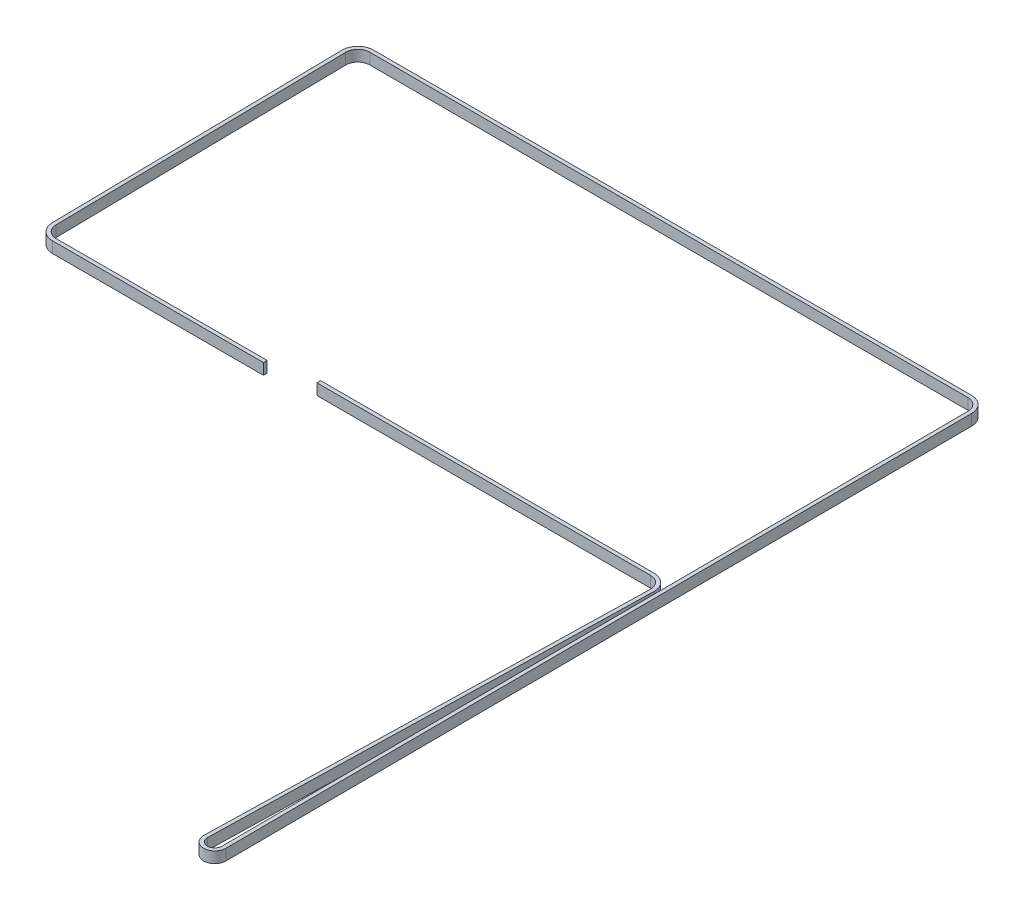
from build123d import *

# Parameters (mm, degrees)
EXTRUDE_THIN1_DEPTH      = 5
EXTRUDE_THIN1_DEPTH_BACK = 1


with BuildPart() as part:
    # Sketch1 → Extrude-Thin1 (new, two sides: drawn at the far end of the back side and taken through both)
    with BuildSketch(Plane(origin=(0, 494, 0), x_dir=(1, 0, 0), z_dir=(0, 1, 0)).offset(-EXTRUDE_THIN1_DEPTH_BACK)):
        with BuildLine():
            Line((-21.192485275, 22.077376905), (159.5, 22.077376905))
            ThreePointArc((159.5, 22.077376905), (164.149331935, 20.119811555), (165.998241995, 15.426211538))
            Line((165.998241995, 15.426211538), (160.501622773, -220.860462738))
            ThreePointArc((160.501622773, -220.860462738), (166.44500383, -226.999747946), (172.499927204, -220.970444157))
            Line((172.499927204, -220.970444157), (170.499896872, 185.041870778))
            ThreePointArc((170.499896872, 185.041870778), (167.995585809, 191.02519301), (162, 193.5))
            Line((162, 193.5), (-162, 193.5))
            ThreePointArc((-162, 193.5), (-168.057344942, 190.963100892), (-170.498955066, 184.866722883))
            Line((-170.498955066, 184.866722883), (-167.998955066, 25.444099787))
            ThreePointArc((-167.998955066, 25.444099787), (-165.463100892, 19.520031962), (-159.5, 17.077376905))
            Line((-159.5, 17.077376905), (-45.192485275, 17.077376905))
            Line((-45.192485275, 17.077376905), (-45.192485275, 19.077376905))
            Line((-45.192485275, 19.077376905), (-159.5, 19.077376905))
            ThreePointArc((-159.5, 19.077376905), (-164.060018329, 20.945289596), (-165.999200933, 25.475459109))
            Line((-165.999200933, 25.475459109), (-168.499200933, 184.898082204))
            ThreePointArc((-168.499200933, 184.898082204), (-166.632087309, 189.560018329), (-162, 191.5))
            Line((-162, 191.5), (162, 191.5))
            ThreePointArc((162, 191.5), (166.584859736, 189.607500537), (168.499921138, 185.03201883))
            Line((168.499921138, 185.03201883), (170.499951469, -220.980296104))
            ThreePointArc((170.499951469, -220.980296104), (166.463335887, -224.999831964), (162.501081849, -220.906975159))
            Line((162.501081849, -220.906975159), (167.997701071, 15.379699117))
            ThreePointArc((167.997701071, 15.379699117), (165.579895607, 21.517483756), (159.5, 24.077376905))
            Line((159.5, 24.077376905), (-21.192485275, 24.077376905))
            Line((-21.192485275, 24.077376905), (-21.192485275, 22.077376905))
        make_face()
    extrude(amount=EXTRUDE_THIN1_DEPTH + EXTRUDE_THIN1_DEPTH_BACK)


solid = part.part
